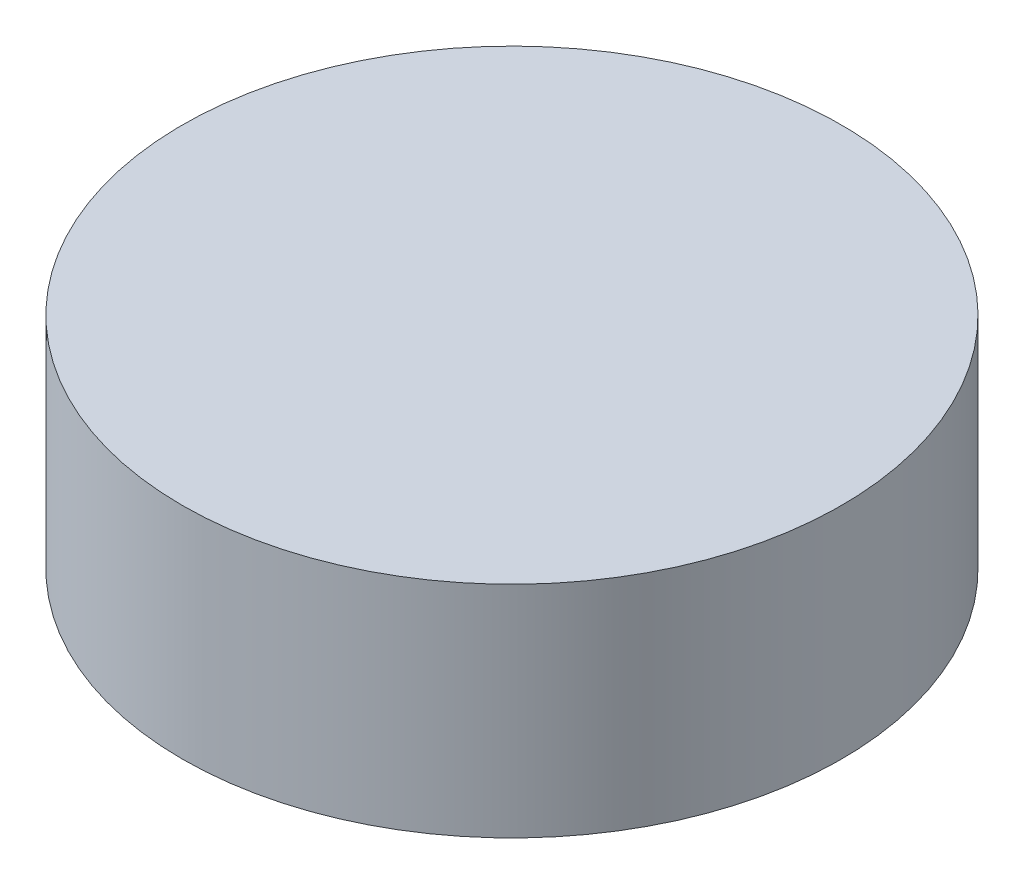
from build123d import *

# Parameters (mm, degrees)
SKETCH1_R           = 30
BOSS_EXTRUDE1_DEPTH = 10
SKETCH2_R           = 23
CUT_EXTRUDE1_DEPTH  = 15


with BuildPart() as part:
    # Sketch1 → Boss-Extrude1 (new, symmetric)
    with BuildSketch(Plane(origin=(0, 0, 0), x_dir=(1, 0, 0), z_dir=(0, 1, 0))):
        with Locations(Location((0, 0, 0), (0, 0, 270))):
            Circle(SKETCH1_R)
    extrude(amount=BOSS_EXTRUDE1_DEPTH, both=True)

    # Sketch2 → Cut-Extrude1 (cut)
    with BuildSketch(Plane.XZ.offset(10)):
        with Locations(Location((0, 0, 0), (0, 0, 270))):
            Circle(SKETCH2_R)
    extrude(amount=-CUT_EXTRUDE1_DEPTH, mode=Mode.SUBTRACT)


solid = part.part
